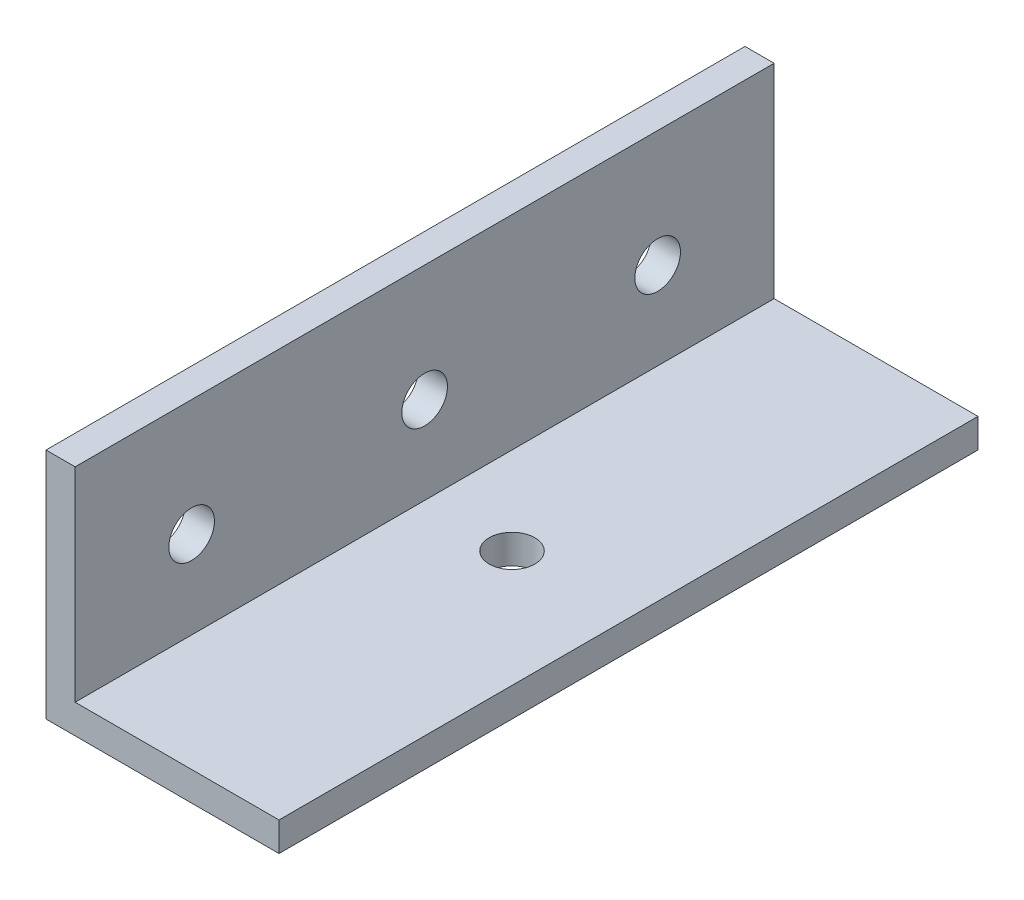
from build123d import *

# Parameters (mm, degrees)
BOSS_EXTRUDE1_DEPTH = 76.2
SKETCH7_R           = 2.4892
CUT_EXTRUDE4_DEPTH  = 84.339970152
SKETCH8_R           = 2.4892
CUT_EXTRUDE5_DEPTH  = 84.339970152


with BuildPart() as part:
    # Sketch1 → Boss-Extrude1 (new body)
    with BuildSketch(Plane.XY):
        Polygon((3.175, 25.4), (3.175, 3.175), (25.4, 3.175), (25.4, 0), (0, 0), (0, 25.4), align=None)
    extrude(amount=BOSS_EXTRUDE1_DEPTH)

    # Sketch7 → Cut-Extrude4 (cut, through all)
    with BuildSketch(Plane(origin=(3.175, 0, 0), x_dir=(0, 0, -1), z_dir=(1, 0, 0))):
        with Locations(Location((-63.5, 12.7, 0), (0, 0, 90))):
            Circle(SKETCH7_R)
        with Locations(Location((-38.1, 12.7, 0), (0, 0, 90))):
            Circle(SKETCH7_R)
        with Locations(Location((-12.7, 12.7, 0), (0, 0, 90))):
            Circle(SKETCH7_R)
    extrude(amount=-CUT_EXTRUDE4_DEPTH, mode=Mode.SUBTRACT)

    # Sketch8 → Cut-Extrude5 (cut, through all)
    with BuildSketch(Plane(origin=(0, 3.175, 0), x_dir=(1, 0, 0), z_dir=(0, 1, 0))):
        with Locations(Location((12.7, -38.1, 0), (0, 0, 270))):
            Circle(SKETCH8_R)
    extrude(amount=-CUT_EXTRUDE5_DEPTH, mode=Mode.SUBTRACT)


solid = part.part
